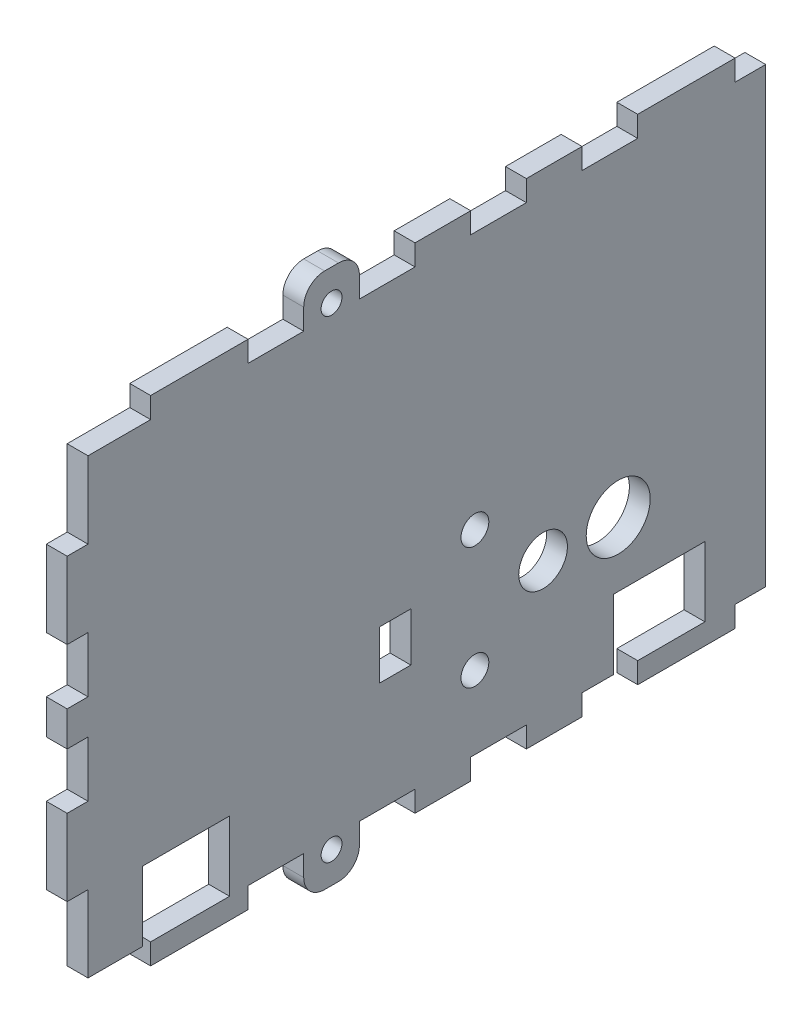
from build123d import *

# Parameters (mm, degrees)
CROQUIS1_W               = 108
CROQUIS1_H               = 71
SALIENTE_EXTRUIR1_DEPTH  = 1.5
CROQUIS2_W               = 12
CROQUIS2_H               = 3
CROQUIS2_W_2             = 8
CORTAR_EXTRUIR1_DEPTH    = 3
CROQUIS4_W               = 8
CROQUIS4_H               = 3
SALIENTE_EXTRUIR2_DEPTH  = 3
REDONDEO1_R              = 3
CROQUIS5_R               = 1.5
CORTAR_EXTRUIR2_DEPTH    = 13
REDONDEO1_OF_SIMETR_A2_R = 3
CROQUIS6_W               = 3
CROQUIS6_H               = 14
CROQUIS6_H_2             = 8
CORTAR_EXTRUIR3_DEPTH    = 3
CROQUIS7_W               = 3.217414859
CROQUIS7_H               = 7.6
CORTAR_EXTRUIR4_DEPTH    = 73
CROQUIS8_R               = 1.5
CROQUIS8_R_2             = 2.5
CROQUIS8_R_3             = 3.6
CROQUIS8_W               = 2.5
CROQUIS8_H               = 6
CORTAR_EXTRUIR5_DEPTH    = 10
CROQUIS9_R               = 2
CROQUIS9_R_2             = 3.5
CROQUIS9_R_3             = 4.6
CROQUIS9_W               = 4.5
CROQUIS9_H               = 7
CORTAR_EXTRUIR6_DEPTH    = 10
CROQUIS10_W              = 13.122983438
CROQUIS10_H              = 10
CORTAR_EXTRUIR7_DEPTH    = 10
CROQUIS11_W              = 12.481361742
CROQUIS11_H              = 10
CORTAR_EXTRUIR8_DEPTH    = 10


with BuildPart() as part:
    # Croquis1 → Saliente-Extruir1 (new, symmetric)
    with BuildSketch(Plane(origin=(0, 0, 0), x_dir=(0, 0, -1), z_dir=(1, 0, 0))):
        Rectangle(CROQUIS1_W, CROQUIS1_H)
    extrude(amount=SALIENTE_EXTRUIR1_DEPTH, both=True)

    # Croquis2 → Cortar-Extruir1 (cut)
    with BuildSketch(Plane.ZY.offset(1.5)):
        with Locations((-48, -34)):
            Rectangle(CROQUIS2_W, CROQUIS2_H)
        with Locations((-24, -34)):
            Rectangle(CROQUIS2_W_2, CROQUIS2_H)
        with Locations((-8, -34)):
            Rectangle(CROQUIS2_W_2, CROQUIS2_H)
        with Locations((8, -34)):
            Rectangle(CROQUIS2_W_2, CROQUIS2_H)
        with Locations((24, -34)):
            Rectangle(CROQUIS2_W_2, CROQUIS2_H)
        with Locations((48, -34)):
            Rectangle(CROQUIS2_W, CROQUIS2_H)
        with Locations((48, 34)):
            Rectangle(CROQUIS2_W, CROQUIS2_H)
        with Locations((24, 34)):
            Rectangle(CROQUIS2_W_2, CROQUIS2_H)
        with Locations((8, 34)):
            Rectangle(CROQUIS2_W_2, CROQUIS2_H)
        with Locations((-8, 34)):
            Rectangle(CROQUIS2_W_2, CROQUIS2_H)
        with Locations((-24, 34)):
            Rectangle(CROQUIS2_W_2, CROQUIS2_H)
        with Locations((-48, 34)):
            Rectangle(CROQUIS2_W, CROQUIS2_H)
    extrude(amount=-CORTAR_EXTRUIR1_DEPTH, mode=Mode.SUBTRACT)

    # Croquis4 → Saliente-Extruir2 (add)
    with BuildSketch(Plane.ZY.offset(1.5)):
        with Locations((16, 37)):
            Rectangle(CROQUIS4_W, CROQUIS4_H)
    saliente_extruir2 = extrude(amount=-SALIENTE_EXTRUIR2_DEPTH)

    # Redondeo1
    redondeo1_edges = [part.edges().sort_by_distance(p)[0] for p in [
        (0, 38.5, 20),
        (0, 38.5, 12),
    ]]
    fillet(redondeo1_edges, radius=REDONDEO1_R)

    # Croquis5 → Cortar-Extruir2 (cut)
    with BuildSketch(Plane.ZY.offset(1.5)):
        with Locations((16, 34)):
            Circle(CROQUIS5_R)
    cortar_extruir2 = extrude(amount=-CORTAR_EXTRUIR2_DEPTH, mode=Mode.SUBTRACT)

    # Simetría2: Saliente-Extruir2, Cortar-Extruir2 across plane
    add(saliente_extruir2.mirror(Plane.ZX))
    add(cortar_extruir2.mirror(Plane.ZX), mode=Mode.SUBTRACT)

    # Redondeo1 of Simetría2
    redondeo1_of_simetr_a2_edges = [part.edges().sort_by_distance(p)[0] for p in [
        (0, -38.5, 20),
        (0, -38.5, 12),
    ]]
    fillet(redondeo1_of_simetr_a2_edges, radius=REDONDEO1_OF_SIMETR_A2_R)

    # Croquis6 → Cortar-Extruir3 (cut)
    with BuildSketch(Plane.ZY.offset(1.5)):
        with Locations((52.5, -28.5)):
            Rectangle(CROQUIS6_W, CROQUIS6_H)
        with Locations((52.5, -6.5)):
            Rectangle(CROQUIS6_W, CROQUIS6_H_2)
        with Locations((52.5, 6.5)):
            Rectangle(CROQUIS6_W, CROQUIS6_H_2)
        with Locations((52.5, 28.5)):
            Rectangle(CROQUIS6_W, CROQUIS6_H)
    extrude(amount=-CORTAR_EXTRUIR3_DEPTH, mode=Mode.SUBTRACT)

    # Croquis7 → Cortar-Extruir4 (cut)
    with BuildSketch(Plane(origin=(0, 32.5, 0), x_dir=(1, 0, 0), z_dir=(0, 1, 0))):
        with Locations((-0.10870743, 50.2)):
            Rectangle(CROQUIS7_W, CROQUIS7_H)
    extrude(amount=-CORTAR_EXTRUIR4_DEPTH, mode=Mode.SUBTRACT)

    # Croquis8 → Cortar-Extruir5 (cut)
    with BuildSketch(Plane(origin=(1.5, 0, 0), x_dir=(0, 0, -1), z_dir=(1, 0, 0))):
        with Locations((4.6, -4.5)):
            Circle(CROQUIS8_R)
        with Locations((4.6, -22)):
            Circle(CROQUIS8_R)
        with Locations((14.4, -13.25)):
            Circle(CROQUIS8_R_2)
        with Locations((25.2, -13.25)):
            Circle(CROQUIS8_R_3)
        with Locations((-6.85, -13.25)):
            Rectangle(CROQUIS8_W, CROQUIS8_H)
    extrude(amount=-CORTAR_EXTRUIR5_DEPTH, mode=Mode.SUBTRACT)

    # Croquis9 → Cortar-Extruir6 (cut)
    with BuildSketch(Plane.ZY.offset(1.5)):
        with Locations((-4.6, -22)):
            Circle(CROQUIS9_R)
        with Locations((-4.6, -4.5)):
            Circle(CROQUIS9_R)
        with Locations((-14.4, -13.25)):
            Circle(CROQUIS9_R_2)
        with Locations((-25.2, -13.25)):
            Circle(CROQUIS9_R_3)
        with Locations((6.85, -13.25)):
            Rectangle(CROQUIS9_W, CROQUIS9_H)
    extrude(amount=-CORTAR_EXTRUIR6_DEPTH, mode=Mode.SUBTRACT)

    # Croquis10 → Cortar-Extruir7 (cut)
    with BuildSketch(Plane.ZY.offset(1.5)):
        with Locations((-31.1, -27.5)):
            Rectangle(CROQUIS10_W, CROQUIS10_H)
    extrude(amount=-CORTAR_EXTRUIR7_DEPTH, mode=Mode.SUBTRACT)

    # Croquis11 → Cortar-Extruir8 (cut)
    with BuildSketch(Plane.ZY.offset(1.5)):
        with Locations((36.9, -27.5)):
            Rectangle(CROQUIS11_W, CROQUIS11_H)
    extrude(amount=-CORTAR_EXTRUIR8_DEPTH, mode=Mode.SUBTRACT)


solid = part.part
